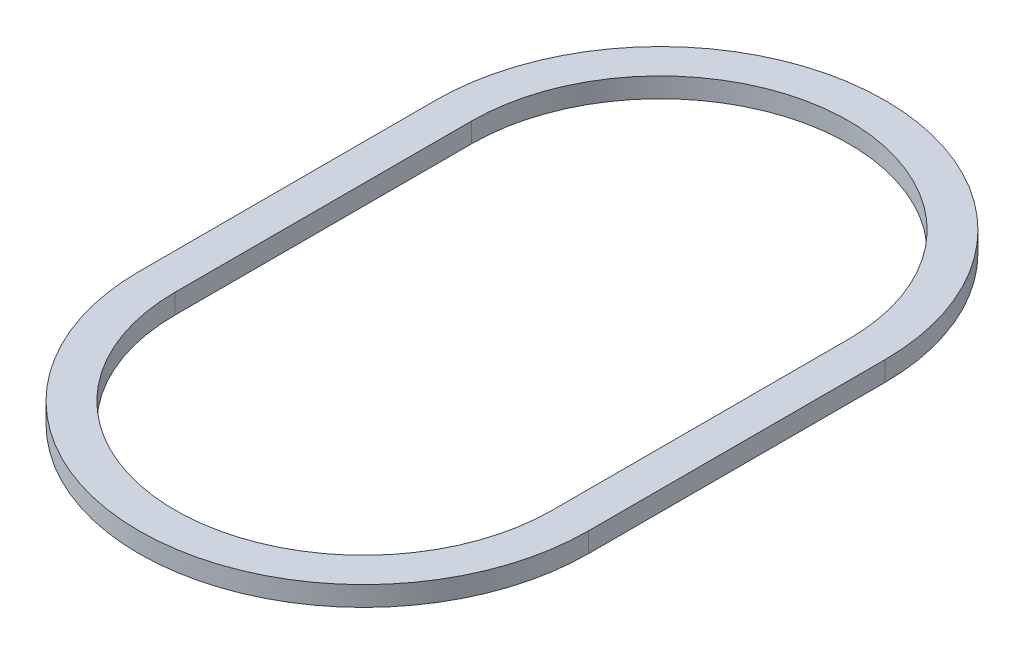
from build123d import *

# Parameters (mm, degrees)
EXTRUDE_1_DEPTH = 2.2


with BuildPart() as part:
    # 草图1 → 凸台-拉伸1 (new body)
    with BuildSketch(Plane(origin=(0, 0, 0), x_dir=(1, 0, 0), z_dir=(0, 1, 0))):
        with BuildLine():
            Line((25, 0), (25, -33))
            ThreePointArc((25, -33), (0, -58), (-25, -33))
            Line((-25, -33), (-25, 0))
            ThreePointArc((-25, 0), (0, 25), (25, 0))
        make_face()
        with BuildLine():
            Line((-21, -33), (-21, 0))
            ThreePointArc((-21, 0), (0, 21), (21, 0))
            Line((21, 0), (21, -33))
            ThreePointArc((21, -33), (0, -54), (-21, -33))
        make_face(mode=Mode.SUBTRACT)
    extrude(amount=EXTRUDE_1_DEPTH)


solid = part.part
